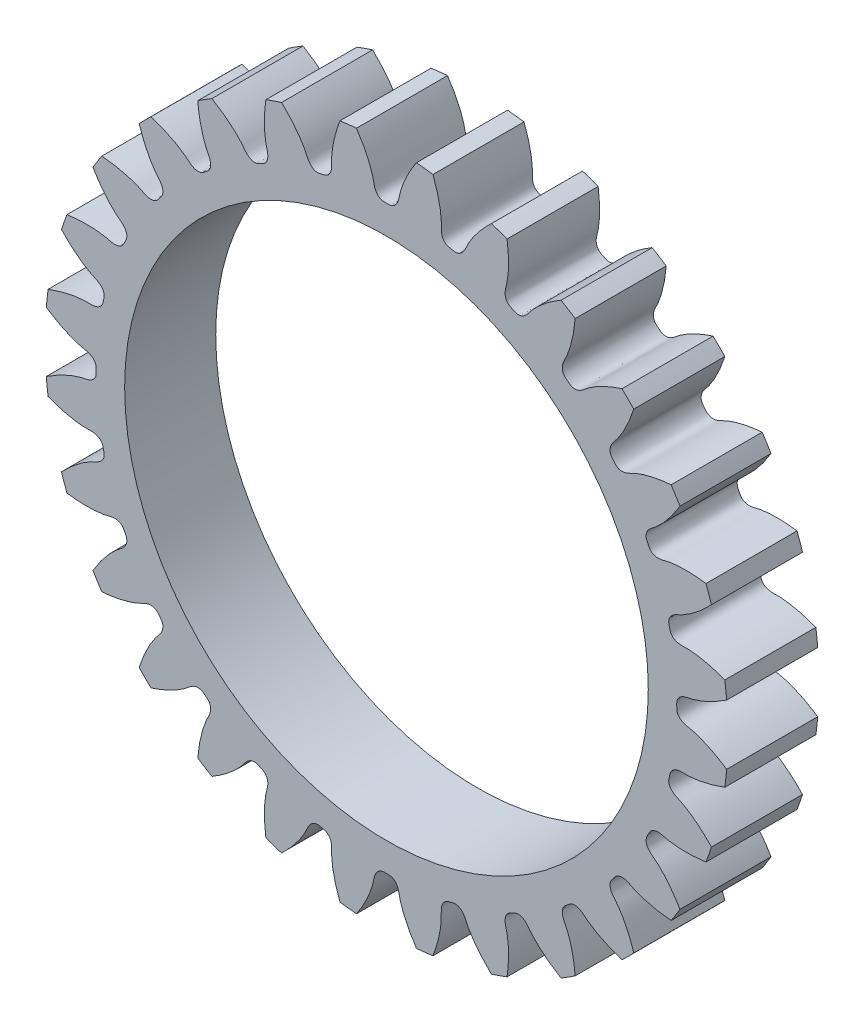
from build123d import *

# Parameters (mm, degrees)
SKETCHREVOLVESPURGEAR_W       = 4
SKETCHREVOLVESPURGEAR_H       = 14.999999775
TOOTHEXTRUDECUTSPURGEAR_DEPTH = 2
PATTERNSPURGEAR_COUNT         = 28
BOREREVOLVESKETCH_W           = 4
BOREREVOLVESKETCH_H           = 11.5


with BuildPart() as part:
    # SketchRevolveSpurGear → SpurGear (revolve)
    with BuildSketch(Plane(origin=(0, 0, 0), x_dir=(0, 0, -1), z_dir=(1, 0, 0))):
        with Locations((0, 7.499999888)):
            Rectangle(SKETCHREVOLVESPURGEAR_W, SKETCHREVOLVESPURGEAR_H)
    revolve(axis=Axis((0, 0, 0), (0, 0, -1)))

    # SketchToothSpurGear → ToothExtrudeCutSpurGear (cut, symmetric)
    with BuildSketch(Plane.XY):
        with BuildLine():
            ThreePointArc((14.989536432, 1.347698316), (15.049999774, 0), (14.989536432, -1.347698316))
            add(Edge.make_bspline(
                [(14.989536432, -1.347698316), (14.834143552, -1.242155758), (14.62732743, -1.112863487), (14.367424713, -0.970875025), (14.227258704, -0.899278518), (14.094327664, -0.835964859), (13.968976602, -0.780473907), (13.851530377, -0.732332382), (13.74229312, -0.691055537), (13.641548824, -0.65614685), (13.549557621, -0.627101888), (13.46656622, -0.603399373), (13.392773595, -0.584532666), (13.277102525, -0.558253835), (13.166357443, -0.540992982), (13.064696915, -0.50561432), (13.014593832, -0.484369701), (12.965835511, -0.458783513), (12.917853446, -0.42737669), (12.87042187, -0.387706303), (12.824503256, -0.336364639), (12.783535685, -0.269789953), (12.757049385, -0.191813167), (12.74648267, -0.099590989), (12.752039086, 0), (12.74648267, 0.099590989), (12.757049385, 0.191813167), (12.783535685, 0.269789953), (12.824503256, 0.336364639), (12.87042187, 0.387706303), (12.917853446, 0.42737669), (12.965835511, 0.458783513), (13.014593832, 0.484369701), (13.064696915, 0.50561432), (13.166357443, 0.540992982), (13.277102525, 0.558253835), (13.392773595, 0.584532666), (13.46656622, 0.603399373), (13.549557621, 0.627101888), (13.641548824, 0.65614685), (13.74229312, 0.691055537), (13.851530377, 0.732332382), (13.968976602, 0.780473907), (14.094327664, 0.835964859), (14.227258704, 0.899278518), (14.367424713, 0.970875025), (14.62732743, 1.112863487), (14.834143552, 1.242155758), (14.989536432, 1.347698316)],
                knots=[0, 0, 0, 0, 0.101925901, 0.132230195, 0.160697866, 0.187328912, 0.212123335, 0.235081134, 0.256202309, 0.27548686, 0.292934788, 0.308546091, 0.322320771, 0.334258827, 0.372935144, 0.382829365, 0.392596991, 0.402447171, 0.412670839, 0.423661924, 0.435910203, 0.449896378, 0.465798495, 0.480169576, 0.5, 0.519830424, 0.534201505, 0.550103622, 0.564089797, 0.576338076, 0.587329161, 0.597552829, 0.607403009, 0.617170635, 0.627064856, 0.665741173, 0.677679229, 0.691453909, 0.707065212, 0.72451314, 0.743797691, 0.764918866, 0.787876665, 0.812671088, 0.839302134, 0.867769805, 0.898074099, 1, 1, 1, 1], degree=3))
        make_face()
    toothextrudecutspurgear = extrude(amount=TOOTHEXTRUDECUTSPURGEAR_DEPTH, both=True, mode=Mode.SUBTRACT)

    # PatternSpurGear: ToothExtrudeCutSpurGear ×28 about axis
    patternspurgear_axis = Axis((0, 0, 55), (0, 0, -1))
    for i in range(1, PATTERNSPURGEAR_COUNT):
        add(toothextrudecutspurgear.rotate(patternspurgear_axis, i * 360 / PATTERNSPURGEAR_COUNT), mode=Mode.SUBTRACT)

    # BoreRevolveSketch → BoreRevolveCut (revolve, cut)
    with BuildSketch(Plane(origin=(0, 0, 0), x_dir=(0, 0, -1), z_dir=(1, 0, 0))):
        with Locations((0, 5.75)):
            Rectangle(BOREREVOLVESKETCH_W, BOREREVOLVESKETCH_H)
    revolve(axis=Axis((0, 0, 0), (0, 0, -1)), mode=Mode.SUBTRACT)


solid = part.part
